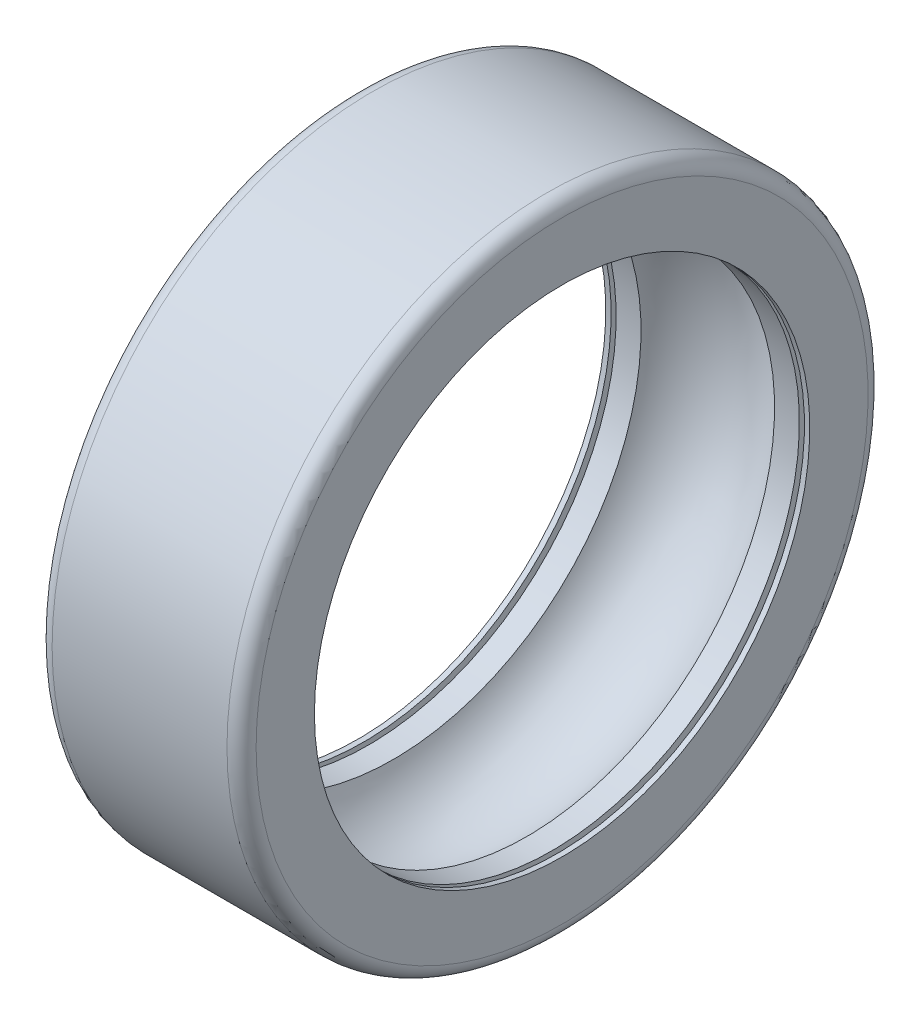
from build123d import *


with BuildPart() as part:
    # Esquisse1 → Révolution1 (revolve)
    with BuildSketch(Plane.XY, mode=Mode.PRIVATE) as r_volution1_sk:
        with BuildLine():
            Line((12.631924887, 11), (18.631924887, 11))
            ThreePointArc((18.631924887, 11), (18.985478277, 10.853553391), (19.131924887, 10.5))
            Line((19.131924887, 10.5), (19.131924887, 8.5))
            Line((19.131924887, 8.5), (18.949161839, 8.5))
            Line((18.949161839, 8.5), (18.949161839, 8.804039909))
            Line((18.949161839, 8.804039909), (18.77636399, 8.804039909))
            Line((18.77636399, 8.804039909), (18.77636399, 8.5))
            Line((18.77636399, 8.5), (17.923212734, 8.5))
            ThreePointArc((17.923212734, 8.5), (15.631924887, 10), (13.340637039, 8.5))
            Line((13.340637039, 8.5), (12.487485783, 8.5))
            Line((12.487485783, 8.5), (12.487485783, 8.804039909))
            Line((12.487485783, 8.804039909), (12.314687935, 8.804039909))
            Line((12.314687935, 8.804039909), (12.314687935, 8.5))
            Line((12.314687935, 8.5), (12.131924887, 8.5))
            Line((12.131924887, 8.5), (12.131924887, 10.5))
            ThreePointArc((12.131924887, 10.5), (12.278371496, 10.853553391), (12.631924887, 11))
        make_face()
    revolve(r_volution1_sk.sketch.rotate(Axis((8.800669459, 0, 0), (1, 0, 0)), 90), axis=Axis((8.800669459, 0, 0), (1, 0, 0)))


solid = part.part
